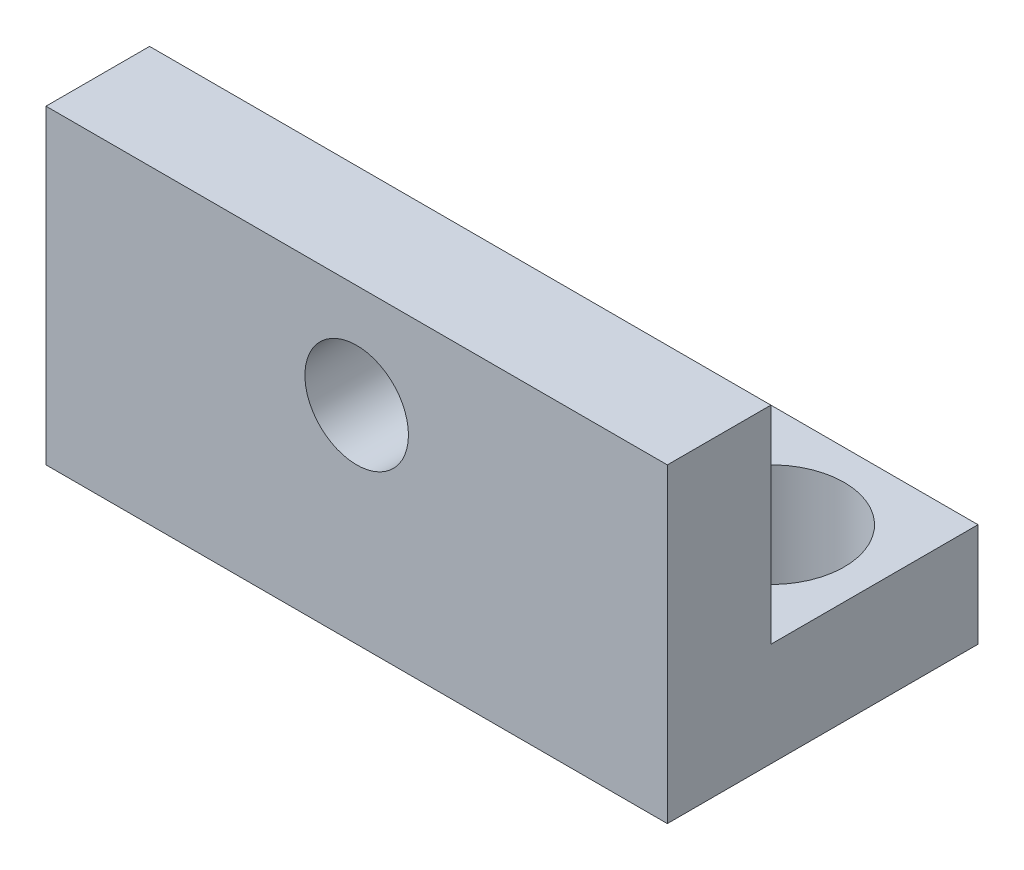
from build123d import *

# Parameters (mm, degrees)
SKETCH1_W             = 19.05
SKETCH1_H             = 6.35
SKETCH1_R             = 1.5875
BOSS_EXTRUDE1_DEPTH   = 3.175
SKETCH2_W             = 19.05
SKETCH2_H             = 9.525
BOSS_EXTRUDE2_DEPTH   = 3.175
F_8_CLEARANCE_HOLE1_D = 4.4958


with BuildPart() as part:
    # Sketch1 → Boss-Extrude1 (new body)
    with BuildSketch(Plane.XY):
        Rectangle(SKETCH1_W, SKETCH1_H)
        Circle(SKETCH1_R, mode=Mode.SUBTRACT)
    extrude(amount=BOSS_EXTRUDE1_DEPTH)

    # Sketch2 → Boss-Extrude2 (add)
    with BuildSketch(Plane.XZ.offset(3.175)):
        with Locations((0, -1.5875)):
            Rectangle(SKETCH2_W, SKETCH2_H)
    extrude(amount=BOSS_EXTRUDE2_DEPTH)

    # #8 Clearance Hole1 (through all)
    with Locations(Plane(origin=(0, -6.35, 0), x_dir=(-1, 0, 0), z_dir=(0, -1, 0))):
        with Locations((-6.35, 3.175), (6.35, 3.175)):
            Hole(F_8_CLEARANCE_HOLE1_D / 2)


solid = part.part
